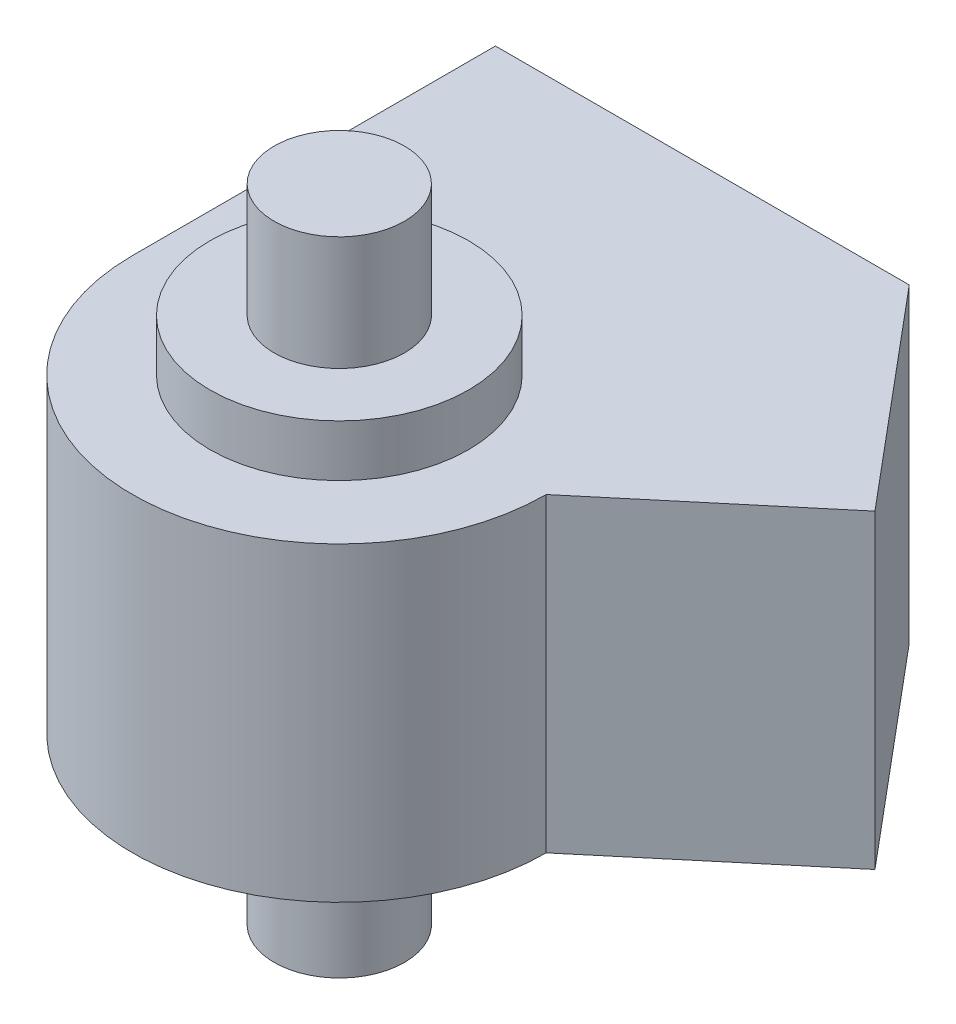
from build123d import *

# Parameters (mm, degrees)
BOSS_EXTRUDE1_DEPTH = 19.05


with BuildPart() as part:
    # Sketch1 → Revolve1 (revolve)
    with BuildSketch(Plane.XY, mode=Mode.PRIVATE) as revolve1_sk:
        Polygon((-4, -19.7), (0, -19.7), (0, 19.7), (-4, 19.7), (-4, 12.7), (-7.9375, 12.7), (-7.9375, 9.525), (-12.7, 9.525), (-12.7, -9.525), (-7.9375, -9.525), (-7.9375, -12.7), (-4, -12.7), align=None)
    revolve(revolve1_sk.sketch.rotate(Axis((0, 0, 0), (0, 1, 0)), 180), axis=Axis((0, 0, 0), (0, 1, 0)))

    # Sketch2 → Boss-Extrude1 (add)
    with BuildSketch(Plane(origin=(0, 9.525, 0), x_dir=(1, 0, 0), z_dir=(0, 1, 0))):
        Polygon((12.7, 0), (23.672555951, 9.207067652), (12.7, 22.283650626), (-12.7, 22.283650626), (-12.7, 0), align=None)
    extrude(amount=-BOSS_EXTRUDE1_DEPTH)


solid = part.part
